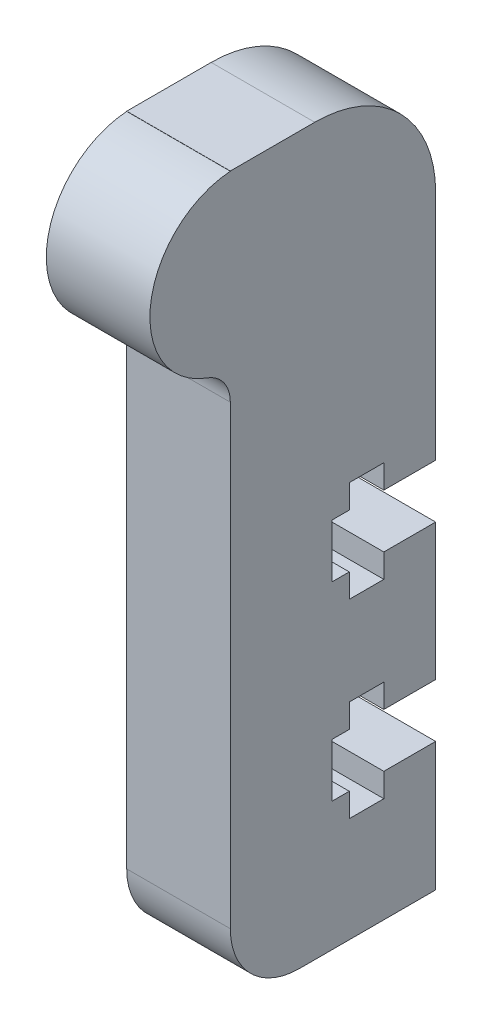
from build123d import *

# Parameters (mm, degrees)
DODANIE_WYCI_GNI_CIE5_DEPTH = 6
WYTNIJ_WYCI_GNI_CIE1_DEPTH  = 20
SZYK_LINIOWY1_COUNT         = 2
SZYK_LINIOWY1_PITCH         = 11


with BuildPart() as part:
    # Szkic8 → Dodanie-wyciągnięcie5 (new body)
    with BuildSketch(Plane(origin=(-151.25, 2.463759923, 0), x_dir=(0, 0, -1), z_dir=(1, 0, 0))):
        with BuildLine():
            Line((0, 53.231732465), (0, 88.231732465))
            ThreePointArc((0, 88.231732465), (-2.050252532, 93.181479934), (-7, 95.231732465))
            Line((-7, 95.231732465), (-11.890119353, 95.231732465))
            Line((-11.890119353, 95.231732465), (-11.889307623, 95.219936285))
            ThreePointArc((-11.889307623, 95.219936285), (-16.499670074, 90.911212793), (-13.219806753, 85.520198357))
            ThreePointArc((-13.219806753, 85.520198357), (-12.255446898, 84.789057353), (-11.889307623, 83.635584713))
            Line((-11.889307623, 83.635584713), (-11.889307623, 57.231732465))
            ThreePointArc((-11.889307623, 57.231732465), (-10.717734748, 54.403305341), (-7.889307623, 53.231732465))
            Line((-7.889307623, 53.231732465), (0, 53.231732465))
        make_face()
    extrude(amount=DODANIE_WYCI_GNI_CIE5_DEPTH)

    # Szkic2 → Wytnij-wyciągnięcie1 (cut)
    with BuildSketch(Plane(origin=(-151.25, 155.607400163, 0), x_dir=(0, 0, -1), z_dir=(-1, 0, 0))):
        Polygon((-6, 81.461907774), (-6, 78.361907774), (-5, 78.361907774), (-5, 76.986907774), (-3, 76.986907774), (-3, 78.361907774), (0, 78.361907774), (0, 81.461907774), (-3, 81.461907774), (-3, 82.836907774), (-5, 82.836907774), (-5, 81.461907774), align=None)
    wytnij_wyci_gni_cie1 = extrude(amount=-WYTNIJ_WYCI_GNI_CIE1_DEPTH, mode=Mode.SUBTRACT)

    # Szyk liniowy1: Wytnij-wyciągnięcie1 ×2
    with Locations(*[(0, -i * SZYK_LINIOWY1_PITCH, 0) for i in range(1, SZYK_LINIOWY1_COUNT)]):
        add(wytnij_wyci_gni_cie1, mode=Mode.SUBTRACT)


solid = part.part
